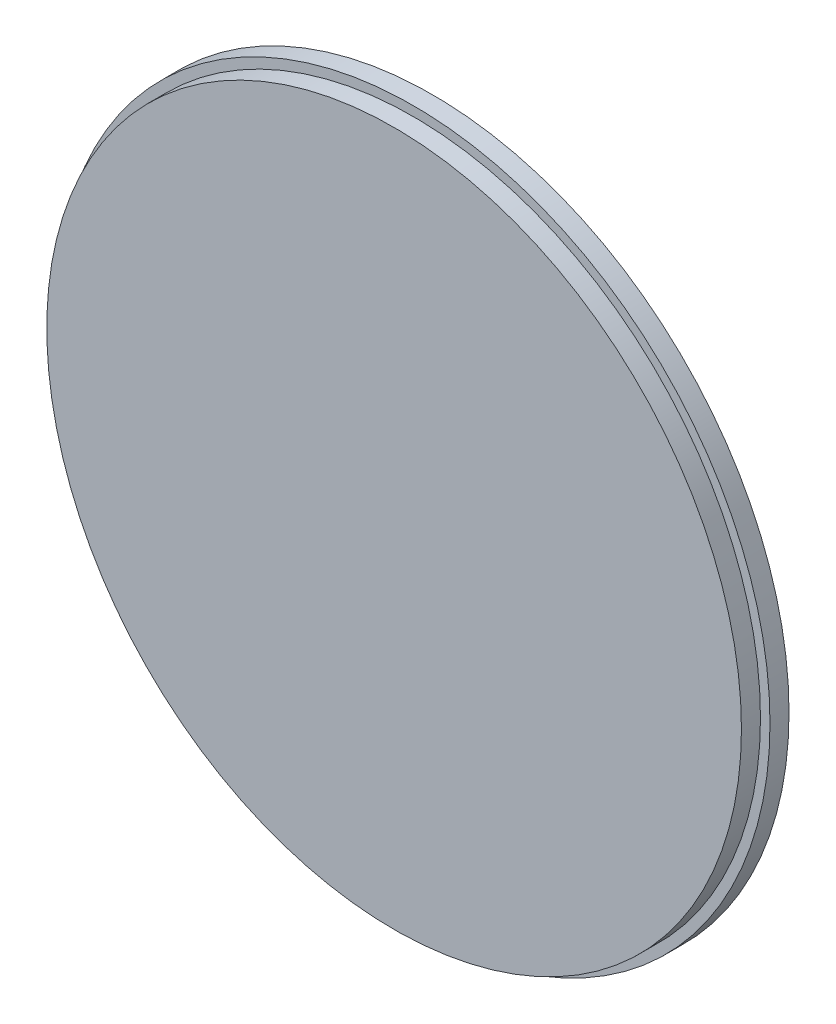
from build123d import *

# Parameters (mm, degrees)
SKETCH1_R           = 18.75
BOSS_EXTRUDE1_DEPTH = 1
SKETCH1_3_R         = 18.25
BOSS_EXTRUDE2_DEPTH = 2


with BuildPart() as part:
    # Sketch1 → Boss-Extrude1 (new body)
    with BuildSketch(Plane.XY):
        Circle(SKETCH1_R)
    extrude(amount=BOSS_EXTRUDE1_DEPTH)

    # Sketch1<3> → Boss-Extrude2 (add)
    with BuildSketch(Plane.XY):
        Circle(SKETCH1_3_R)
    extrude(amount=BOSS_EXTRUDE2_DEPTH)


solid = part.part
